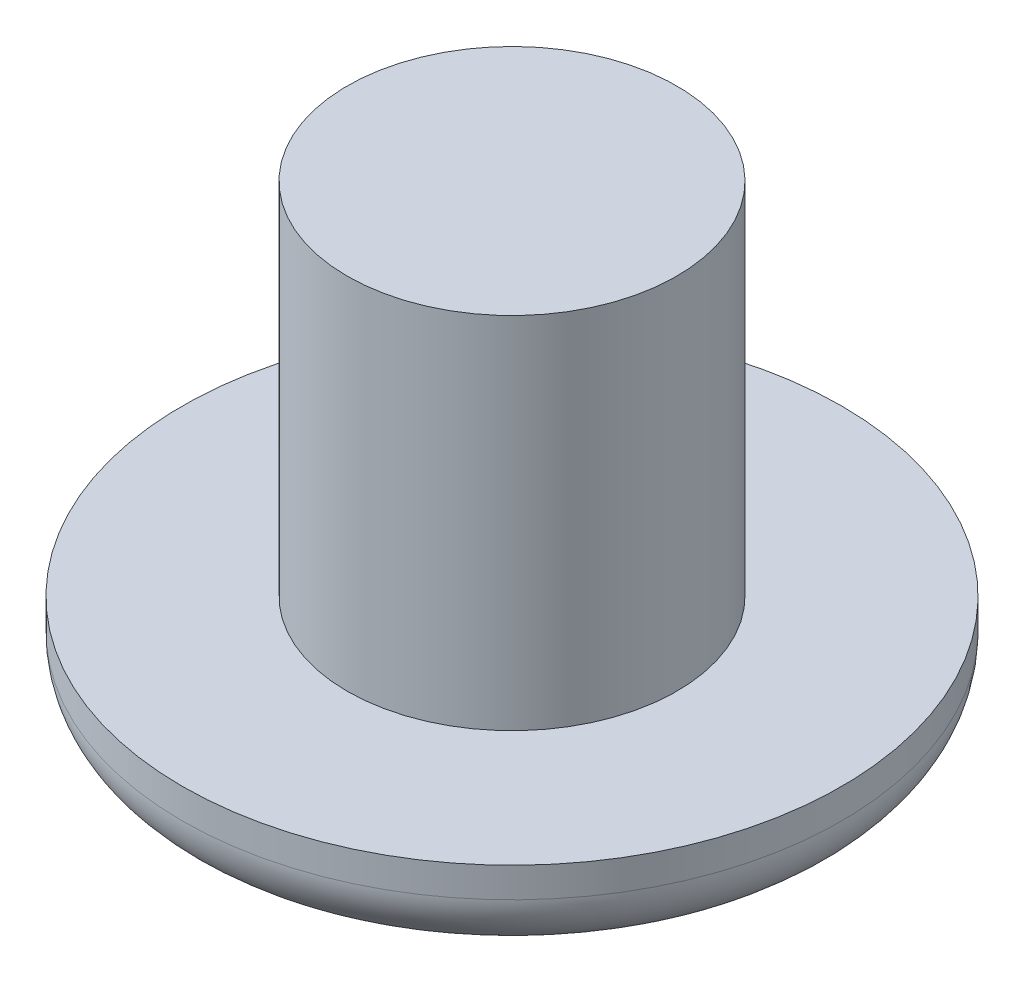
from build123d import *

# Parameters (mm, degrees)
SKETCH1_R           = 11
SKETCH1_R_2         = 5.5
BOSS_EXTRUDE1_DEPTH = 3
SKETCH1_2_R         = 5.5
BOSS_EXTRUDE2_DEPTH = 15
FILLET1_R           = 2


with BuildPart() as part:
    # Sketch1 → Boss-Extrude1 (new body)
    with BuildSketch(Plane(origin=(0, 0, 0), x_dir=(1, 0, 0), z_dir=(0, 1, 0))):
        Circle(SKETCH1_R)
        Circle(SKETCH1_R_2, mode=Mode.SUBTRACT)
    extrude(amount=BOSS_EXTRUDE1_DEPTH)

    # Sketch1<2> → Boss-Extrude2 (add)
    with BuildSketch(Plane(origin=(0, 0, 0), x_dir=(1, 0, 0), z_dir=(0, 1, 0))):
        Circle(SKETCH1_2_R)
    extrude(amount=BOSS_EXTRUDE2_DEPTH)

    # Fillet1
    fillet1_edges = [part.edges().sort_by_distance(p)[0] for p in [
        (-11, 0, 0),
    ]]
    fillet(fillet1_edges, radius=FILLET1_R)


solid = part.part
